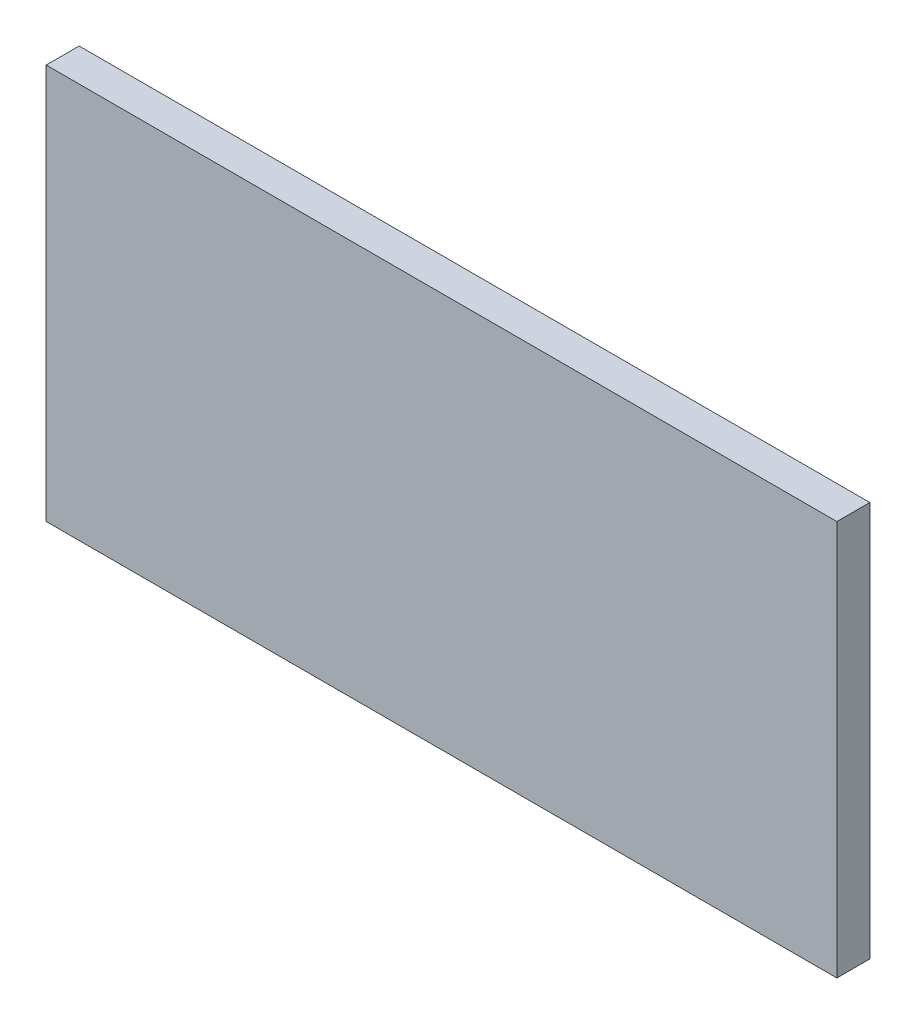
from build123d import *

# Parameters (mm, degrees)
BOSS_EXTRUDE1_DEPTH      = 25
BOSS_EXTRUDE1_DEPTH_BACK = 25
SKETCH1_W                = 1200
SKETCH1_H                = 600


with BuildPart() as part:
    # Sketch1 → Boss-Extrude1 (new, two sides: drawn at the far end of the back side and taken through both)
    with BuildSketch(Plane.XY.offset(-BOSS_EXTRUDE1_DEPTH_BACK)):
        Rectangle(SKETCH1_W, SKETCH1_H)
    extrude(amount=BOSS_EXTRUDE1_DEPTH + BOSS_EXTRUDE1_DEPTH_BACK)


solid = part.part
